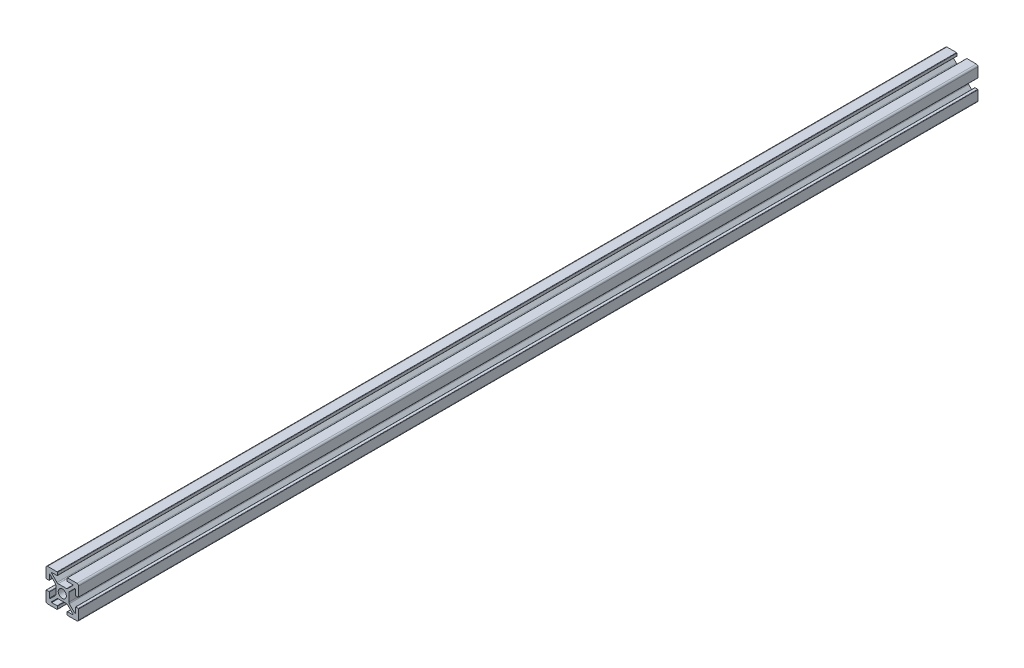
from build123d import *

# Parameters (mm, degrees)
SKETCH1_R           = 2.5
BOSS_EXTRUDE1_DEPTH = 552


with BuildPart() as part:
    # Sketch1 → Boss-Extrude1 (new body)
    with BuildSketch(Plane.XY):
        with BuildLine():
            Line((0.2, 13), (1.8, 13))
            ThreePointArc((1.8, 13), (1.941421356, 13.058578644), (2, 13.2))
            Line((2, 13.2), (2, 16.5))
            Line((2, 16.5), (2.439339828, 16.5))
            Line((2.439339828, 16.5), (5.707106781, 13.232233047))
            ThreePointArc((5.707106781, 13.232233047), (5.923879533, 12.907809698), (6, 12.525126266))
            Line((6, 12.525126266), (6, 7.474873734))
            ThreePointArc((6, 7.474873734), (5.923879533, 7.092190302), (5.707106781, 6.767766953))
            Line((5.707106781, 6.767766953), (2.439339828, 3.5))
            Line((2.439339828, 3.5), (2, 3.5))
            Line((2, 3.5), (2, 6.8))
            ThreePointArc((2, 6.8), (1.941421356, 6.941421356), (1.8, 7))
            Line((1.8, 7), (0.2, 7))
            ThreePointArc((0.2, 7), (0.058578644, 6.941421356), (0, 6.8))
            Line((0, 6.8), (0, 1))
            ThreePointArc((0, 1), (0.292893219, 0.292893219), (1, 0))
            Line((1, 0), (6.8, 0))
            ThreePointArc((6.8, 0), (6.941421356, 0.058578644), (7, 0.2))
            Line((7, 0.2), (7, 1.8))
            ThreePointArc((7, 1.8), (6.941421356, 1.941421356), (6.8, 2))
            Line((6.8, 2), (3.5, 2))
            Line((3.5, 2), (3.5, 2.439339828))
            Line((3.5, 2.439339828), (6.767766953, 5.707106781))
            ThreePointArc((6.767766953, 5.707106781), (7.092190302, 5.923879533), (7.474873734, 6))
            Line((7.474873734, 6), (10, 6))
            Line((10, 6), (12.525126266, 6))
            ThreePointArc((12.525126266, 6), (12.907809698, 5.923879533), (13.232233047, 5.707106781))
            Line((13.232233047, 5.707106781), (16.5, 2.439339828))
            Line((16.5, 2.439339828), (16.5, 2))
            Line((16.5, 2), (13.2, 2))
            ThreePointArc((13.2, 2), (13.058578644, 1.941421356), (13, 1.8))
            Line((13, 1.8), (13, 0.2))
            ThreePointArc((13, 0.2), (13.058578644, 0.058578644), (13.2, 0))
            Line((13.2, 0), (19, 0))
            ThreePointArc((19, 0), (19.707106781, 0.292893219), (20, 1))
            Line((20, 1), (20, 6.8))
            ThreePointArc((20, 6.8), (19.941421356, 6.941421356), (19.8, 7))
            Line((19.8, 7), (18.2, 7))
            ThreePointArc((18.2, 7), (18.058578644, 6.941421356), (18, 6.8))
            Line((18, 6.8), (18, 3.5))
            Line((18, 3.5), (17.560660172, 3.5))
            Line((17.560660172, 3.5), (14.292893219, 6.767766953))
            ThreePointArc((14.292893219, 6.767766953), (14.076120467, 7.092190302), (14, 7.474873734))
            Line((14, 7.474873734), (14, 12.525126266))
            ThreePointArc((14, 12.525126266), (14.076120467, 12.907809698), (14.292893219, 13.232233047))
            Line((14.292893219, 13.232233047), (17.560660172, 16.5))
            Line((17.560660172, 16.5), (18, 16.5))
            Line((18, 16.5), (18, 13.2))
            ThreePointArc((18, 13.2), (18.058578644, 13.058578644), (18.2, 13))
            Line((18.2, 13), (19.8, 13))
            ThreePointArc((19.8, 13), (19.941421356, 13.058578644), (20, 13.2))
            Line((20, 13.2), (20, 19))
            ThreePointArc((20, 19), (19.707106781, 19.707106781), (19, 20))
            Line((19, 20), (13.2, 20))
            ThreePointArc((13.2, 20), (13.058578644, 19.941421356), (13, 19.8))
            Line((13, 19.8), (13, 18.2))
            ThreePointArc((13, 18.2), (13.058578644, 18.058578644), (13.2, 18))
            Line((13.2, 18), (16.5, 18))
            Line((16.5, 18), (16.5, 17.560660172))
            Line((16.5, 17.560660172), (13.232233047, 14.292893219))
            ThreePointArc((13.232233047, 14.292893219), (12.907809698, 14.076120467), (12.525126266, 14))
            Line((12.525126266, 14), (10, 14))
            Line((10, 14), (7.474873734, 14))
            ThreePointArc((7.474873734, 14), (7.092190302, 14.076120467), (6.767766953, 14.292893219))
            Line((6.767766953, 14.292893219), (3.5, 17.560660172))
            Line((3.5, 17.560660172), (3.5, 18))
            Line((3.5, 18), (6.8, 18))
            ThreePointArc((6.8, 18), (6.941421356, 18.058578644), (7, 18.2))
            Line((7, 18.2), (7, 19.8))
            ThreePointArc((7, 19.8), (6.941421356, 19.941421356), (6.8, 20))
            Line((6.8, 20), (1, 20))
            ThreePointArc((1, 20), (0.292893219, 19.707106781), (0, 19))
            Line((0, 19), (0, 13.2))
            ThreePointArc((0, 13.2), (0.058578644, 13.058578644), (0.2, 13))
        make_face()
        with Locations((10, 10)):
            Circle(SKETCH1_R, mode=Mode.SUBTRACT)
    extrude(amount=BOSS_EXTRUDE1_DEPTH)


solid = part.part
